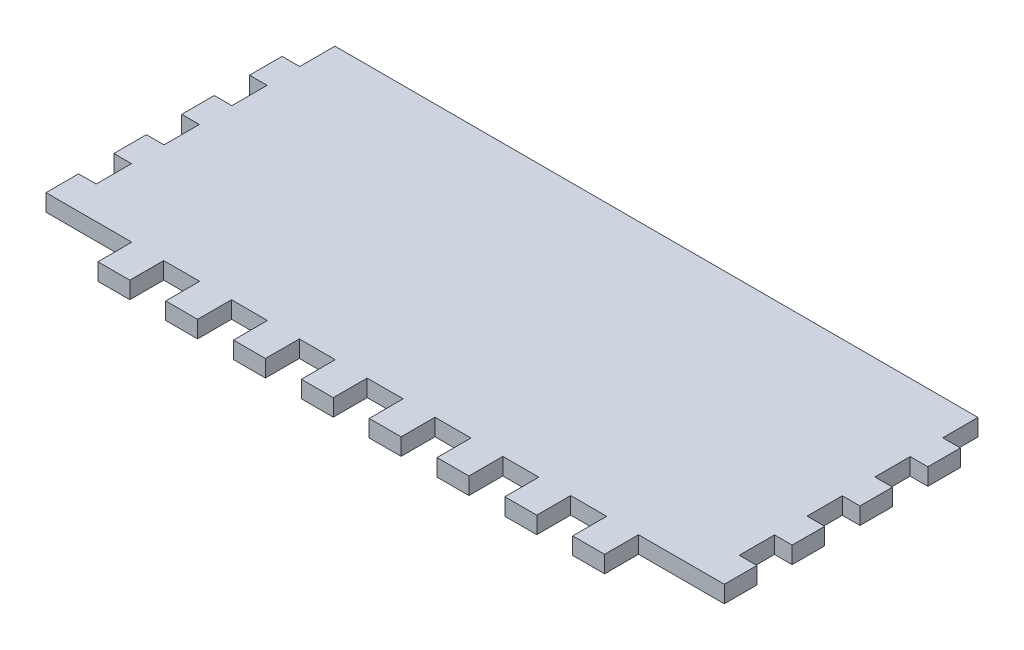
from build123d import *

# Parameters (mm, degrees)
SKETCH1_W           = 127
SKETCH1_H           = 107.95
BOSS_EXTRUDE1_DEPTH = 3.175
SKETCH2_W           = 3.302
SKETCH2_H           = 6.604
CUT_EXTRUDE1_DEPTH  = 84.400427157
SKETCH3_W           = 127
SKETCH3_H           = 50.8
CUT_EXTRUDE2_DEPTH  = 84.400427157


with BuildPart() as part:
    # Sketch1 → Boss-Extrude1 (new body)
    with BuildSketch(Plane(origin=(0, 0, 0), x_dir=(1, 0, 0), z_dir=(0, 1, 0))):
        Rectangle(SKETCH1_W, SKETCH1_H)
    extrude(amount=BOSS_EXTRUDE1_DEPTH)

    # Sketch2 → Cut-Extrude1 (cut, through all)
    with BuildSketch(Plane.XZ):
        Polygon((-34.7345, 47.625), (-41.4655, 47.625), (-41.4655, 54.229), (-47.4345, 54.229), (-47.4345, 47.625), (-60.198, 47.625), (-63.5, 47.625), (-63.5, 54.229), (-63.5, 63.03162391), (63.5, 63.03162391), (63.5, 54.229), (63.5, 47.625), (60.198, 47.625), (47.4345, 47.625), (47.4345, 54.229), (41.4655, 54.229), (41.4655, 47.625), (34.7345, 47.625), (34.7345, 54.229), (28.7655, 54.229), (28.7655, 47.625), (22.0345, 47.625), (22.0345, 54.229), (16.0655, 54.229), (16.0655, 47.625), (9.3345, 47.625), (9.3345, 54.229), (3.3655, 54.229), (3.3655, 47.625), (-3.3655, 47.625), (-3.3655, 54.229), (-9.3345, 54.229), (-9.3345, 47.625), (-16.0655, 47.625), (-16.0655, 54.229), (-22.0345, 54.229), (-22.0345, 47.625), (-28.7655, 47.625), (-28.7655, 54.229), (-34.7345, 54.229), align=None)
        with Locations((61.849, 38.227)):
            Rectangle(SKETCH2_W, SKETCH2_H)
        with Locations((61.849, 25.527)):
            Rectangle(SKETCH2_W, SKETCH2_H)
        with Locations((61.849, 12.827)):
            Rectangle(SKETCH2_W, SKETCH2_H)
        with Locations((61.849, 0.127)):
            Rectangle(SKETCH2_W, SKETCH2_H)
        with Locations((61.849, -12.573)):
            Rectangle(SKETCH2_W, SKETCH2_H)
        with Locations((61.849, -25.273)):
            Rectangle(SKETCH2_W, SKETCH2_H)
        with Locations((61.849, -37.973)):
            Rectangle(SKETCH2_W, SKETCH2_H)
        with Locations((-61.849, -37.973)):
            Rectangle(SKETCH2_W, SKETCH2_H)
        with Locations((-61.849, -25.273)):
            Rectangle(SKETCH2_W, SKETCH2_H)
        with Locations((-61.849, -12.573)):
            Rectangle(SKETCH2_W, SKETCH2_H)
        with Locations((-61.849, 0.127)):
            Rectangle(SKETCH2_W, SKETCH2_H)
        with Locations((-61.849, 12.827)):
            Rectangle(SKETCH2_W, SKETCH2_H)
        with Locations((-61.849, 25.527)):
            Rectangle(SKETCH2_W, SKETCH2_H)
        with Locations((-61.849, 38.227)):
            Rectangle(SKETCH2_W, SKETCH2_H)
        with Locations((61.849, -50.673)):
            Rectangle(SKETCH2_W, SKETCH2_H)
        with Locations((-61.849, -50.673)):
            Rectangle(SKETCH2_W, SKETCH2_H)
    extrude(amount=-CUT_EXTRUDE1_DEPTH, mode=Mode.SUBTRACT)

    # Sketch3 → Cut-Extrude2 (cut, through all)
    with BuildSketch(Plane(origin=(0, 3.175, 0), x_dir=(1, 0, 0), z_dir=(0, 1, 0))):
        with Locations((0, 28.575)):
            Rectangle(SKETCH3_W, SKETCH3_H)
    extrude(amount=-CUT_EXTRUDE2_DEPTH, mode=Mode.SUBTRACT)


solid = part.part
